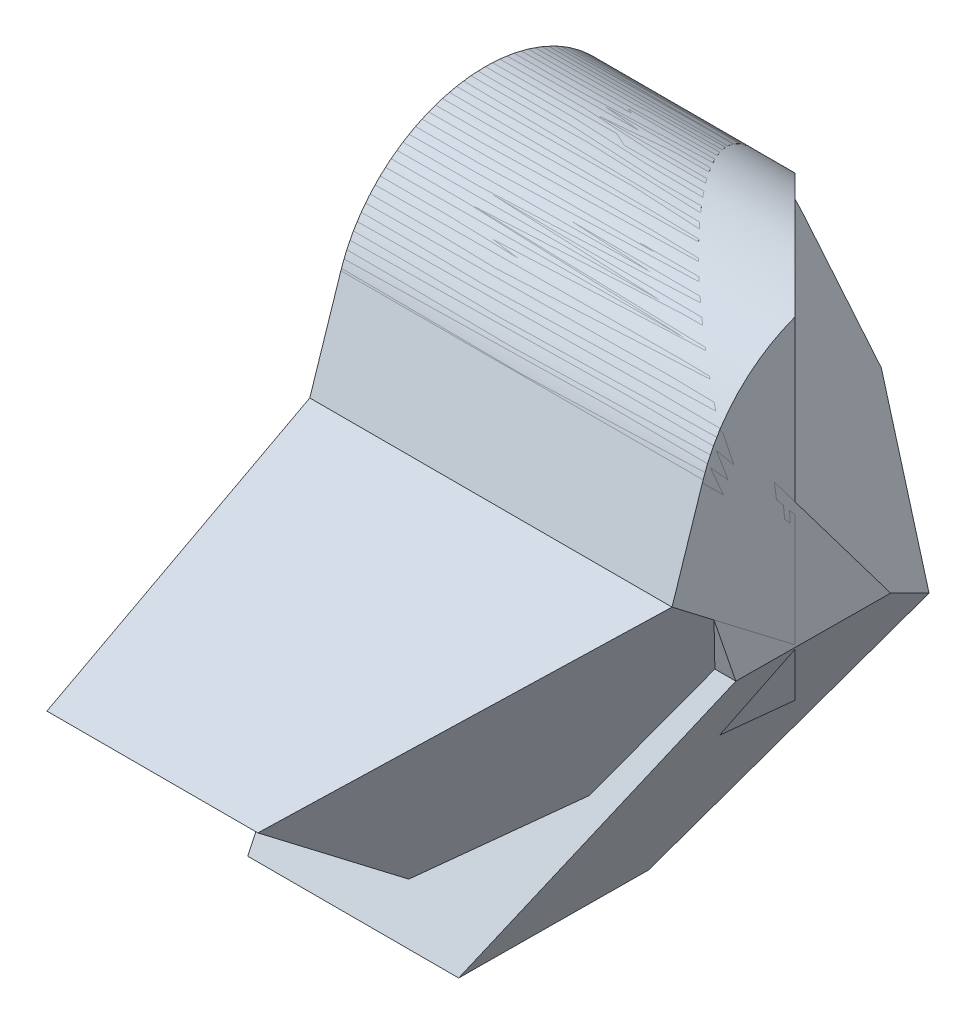
from build123d import *

# Parameters (mm, degrees)
BOSS_EXTRUDE1_DEPTH   = 294.64
CUT_EXTRUDE1_DEPTH    = 704.716871708
CUT_EXTRUDE2_DEPTH    = 508
BODY_MOVE_COPY1_ANGLE = 37


with BuildPart() as part:
    # Sketch5 → Boss-Extrude1 (new body)
    with BuildSketch(Plane(origin=(0, 0, 0), x_dir=(0, 0, -1), z_dir=(1, 0, 0))):
        with BuildLine():
            Line((630.918653705, -339.246293582), (671.731843243, -249.812377847))
            ThreePointArc((671.731843243, -249.812377847), (604.31442152, -83.45620475), (441.95509754, -159.999885065))
            Line((441.95509754, -159.999885065), (416.689109467, -236.990228794))
            Line((416.689109467, -236.990228794), (202.88291861, -350.659793782))
            Line((202.88291861, -350.659793782), (325.58795638, -444.595462006))
            Line((325.58795638, -444.595462006), (630.918653705, -339.246293582))
        make_face()
    extrude(amount=BOSS_EXTRUDE1_DEPTH)

    # Sketch6 → Cut-Extrude1 (cut, through all, along a direction that is not the sketch's normal)
    with BuildSketch(Plane(origin=(0, -357.480445292, -190.053648799), x_dir=(1, 0, 0), z_dir=(0, 0.8829701940215965, 0.4694290537125546))):
        Polygon((171.572820376, 14.529674839), (294.64, 256.673964991), (294.64, 14.529674839), align=None)
    extrude(amount=-CUT_EXTRUDE1_DEPTH, dir=(0, 0.6078681698120333, 0.7940379639093895), mode=Mode.SUBTRACT)

    # Sketch7 → Cut-Extrude2 (cut)
    with BuildSketch(Plane(origin=(0, 0, 0), x_dir=(1, 0, 0), z_dir=(0, 1, 0))):
        Polygon((294.64, 516.677359611), (128.37668115, 682.881986003), (213.761174753, 768.488563361), (374.595192285, 618.643197325), align=None)
    extrude(amount=-CUT_EXTRUDE2_DEPTH, mode=Mode.SUBTRACT)


with BuildPart() as body_2:
    # Body-Move/Copy1: copy of part
    add(part.part.rotate(Axis((0, -198.52182756, -559.338893703), (1, 0, 0)), BODY_MOVE_COPY1_ANGLE))


solid = Compound([part.part, body_2.part])
